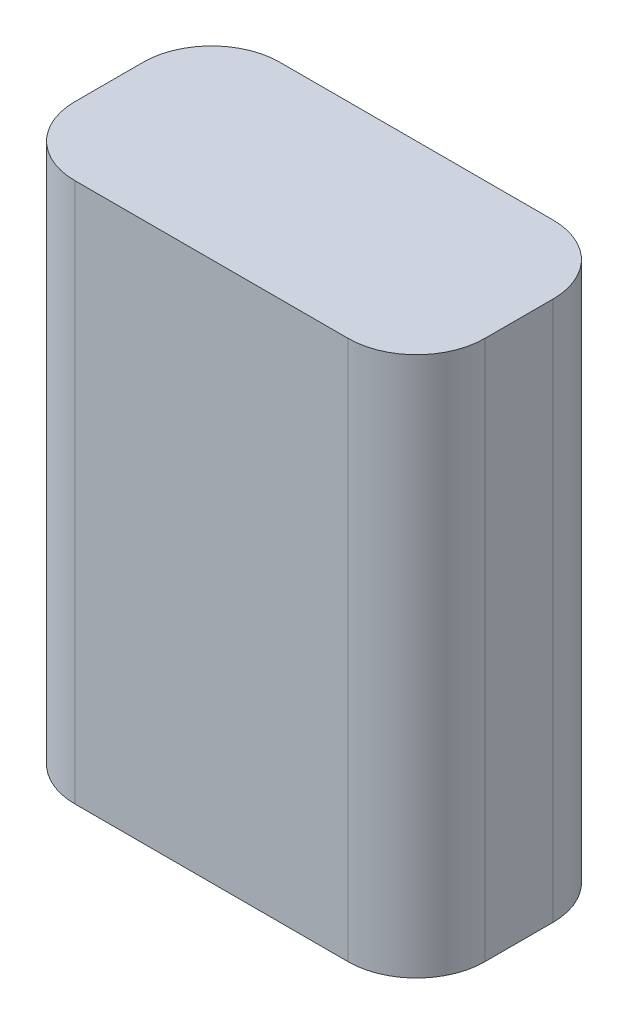
from build123d import *

# Parameters (mm, degrees)
BOSS_EXTRUDE1_DEPTH = 19.75


with BuildPart() as part:
    # Sketch1 → Boss-Extrude1 (new body)
    with BuildSketch(Plane(origin=(0, 0, 0), x_dir=(1, 0, 0), z_dir=(0, 1, 0))):
        with BuildLine():
            Line((-5, 3.75), (5, 3.75))
            ThreePointArc((5, 3.75), (6.767766953, 3.017766953), (7.5, 1.25))
            Line((7.5, 1.25), (7.5, -1.25))
            ThreePointArc((7.5, -1.25), (6.767766953, -3.017766953), (5, -3.75))
            Line((5, -3.75), (-5, -3.75))
            ThreePointArc((-5, -3.75), (-6.767766953, -3.017766953), (-7.5, -1.25))
            Line((-7.5, -1.25), (-7.5, 1.25))
            ThreePointArc((-7.5, 1.25), (-6.767766953, 3.017766953), (-5, 3.75))
        make_face()
    extrude(amount=BOSS_EXTRUDE1_DEPTH)


solid = part.part
